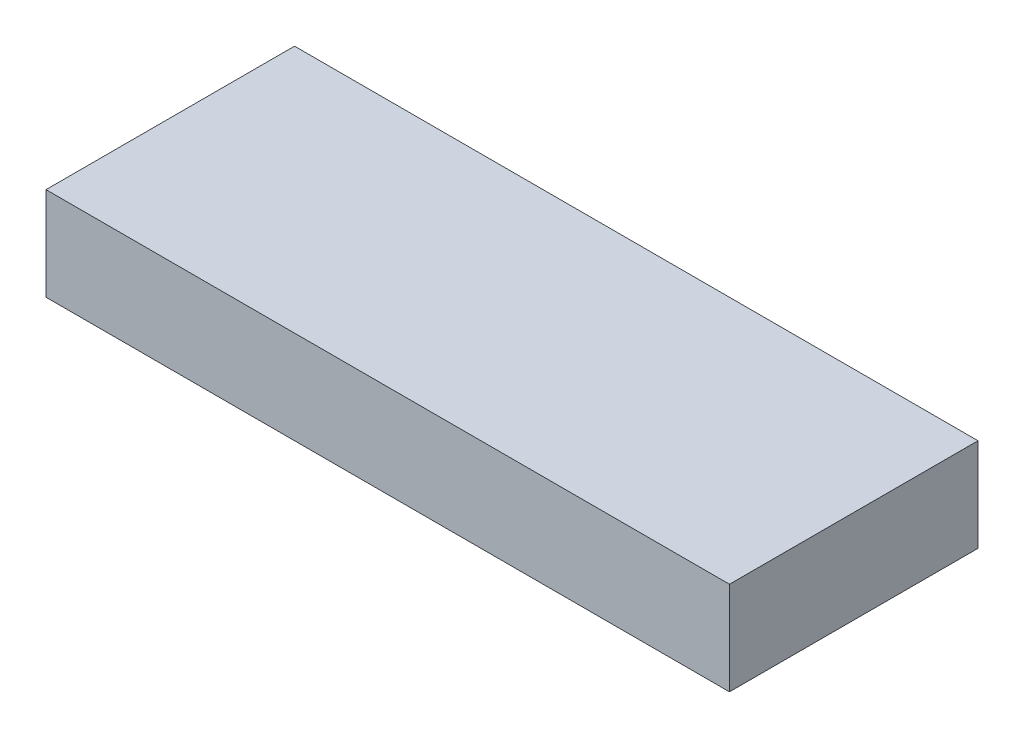
from build123d import *

# Parameters (mm, degrees)
SKETCH_1_W      = 2200
SKETCH_1_H      = 800
EXTRUDE_1_DEPTH = 300


with BuildPart() as part:
    # 草图1 → 凸台-拉伸1 (new body)
    with BuildSketch(Plane(origin=(0, 0, 0), x_dir=(1, 0, 0), z_dir=(0, 1, 0))):
        Rectangle(SKETCH_1_W, SKETCH_1_H)
    extrude(amount=EXTRUDE_1_DEPTH)


solid = part.part
